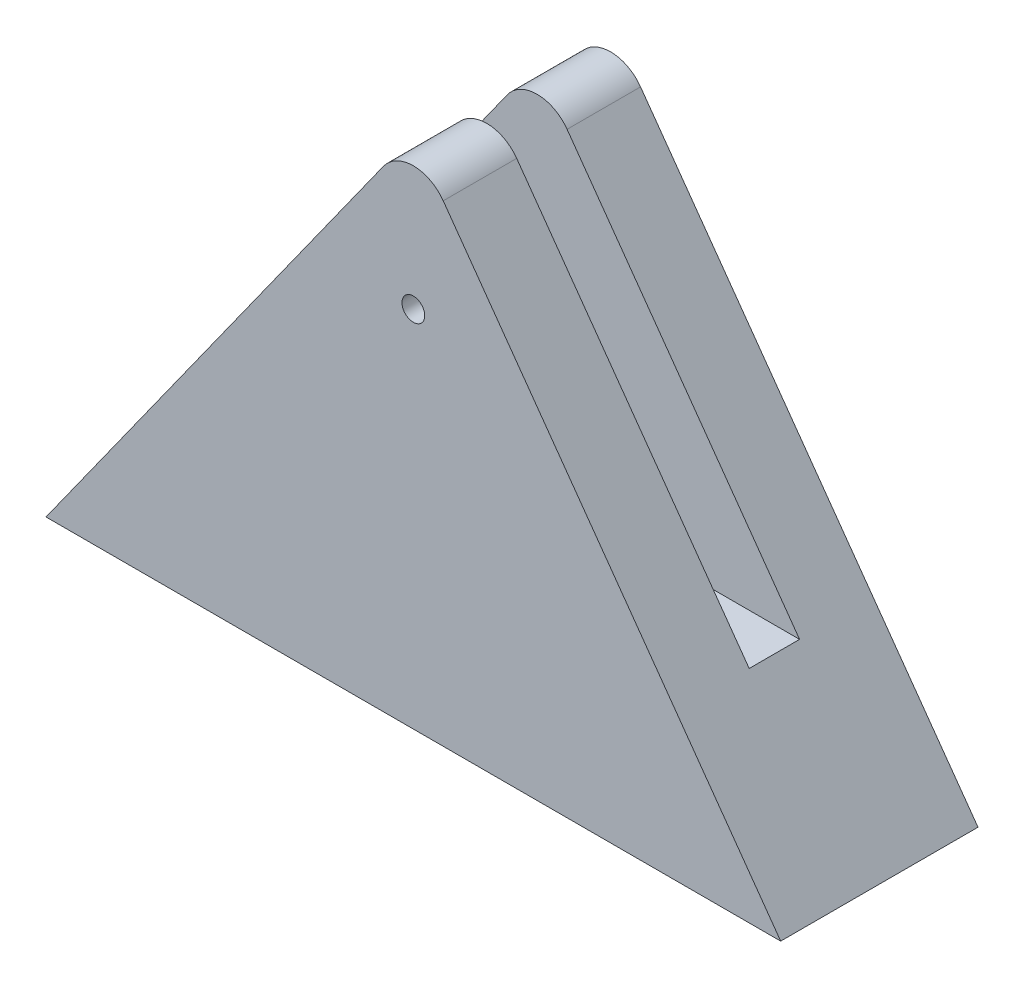
from build123d import *

# Parameters (mm, degrees)
BOSS_EXTRUDE1_DEPTH = 26.858
CUT_EXTRUDE1_REACH  = 113.995
SKETCH2_W           = 6.858
SKETCH2_H           = 50
CUT_EXTRUDE2_REACH  = 74.541
SKETCH3_R           = 1.55
FILLET1_R           = 5


with BuildPart() as part:
    # Sketch1 → Boss-Extrude1 (new body)
    with BuildSketch(Plane.XY):
        Polygon((-47.852923476, -42.680149177), (2.147076524, 27.319850823), (52.147076524, -42.680149177), align=None)
    extrude(amount=BOSS_EXTRUDE1_DEPTH)

    # Cut-Extrude1: up to this plane
    cut_extrude1_end = Plane(origin=(-47.852923476, -42.680149177, 26.858), z_dir=(0.8137334712067356, -0.5812381937190956, 0))
    # Sketch2 → Cut-Extrude1 (cut, up to the surface)
    with BuildSketch(Plane.ZY.offset(-52.147076524), mode=Mode.PRIVATE) as cut_extrude1_sk1:
        with Locations((13.429, 2.319850823)):
            Rectangle(SKETCH2_W, SKETCH2_H)
    cut_extrude1_tool1 = split(extrude(cut_extrude1_sk1.sketch, amount=CUT_EXTRUDE1_REACH, mode=Mode.PRIVATE), bisect_by=cut_extrude1_end, keep=Keep.BOTH, mode=Mode.PRIVATE)
    add(cut_extrude1_tool1.solids().sort_by_distance((52.147077, 2.319851, 13.429))[0], mode=Mode.SUBTRACT)

    # Cut-Extrude2: up to this face of the body (flat: up to its plane)
    cut_extrude2_end = Plane(part.part.faces().sort_by_distance((2.147076524, -19.346815843, 0))[0])
    # Sketch3 → Cut-Extrude2 (cut, up to the picked face)
    with BuildSketch(Plane.XY.offset(26.858), mode=Mode.PRIVATE) as cut_extrude2_sk1:
        with Locations((2.147076524, 6.819850823)):
            Circle(SKETCH3_R)
    cut_extrude2_tool1 = split(extrude(cut_extrude2_sk1.sketch, amount=-CUT_EXTRUDE2_REACH, mode=Mode.PRIVATE), bisect_by=cut_extrude2_end, keep=Keep.BOTH, mode=Mode.PRIVATE)
    add(cut_extrude2_tool1.solids().sort_by(Axis((2.147077, 6.819851, 26.858), (0, 0, -1)))[0], mode=Mode.SUBTRACT)

    # Fillet1
    fillet1_edges = [part.edges().sort_by_distance(p)[0] for p in [
        (2.147076524, 27.319850823, 5),
        (2.147076524, 27.319850823, 21.858),
    ]]
    fillet(fillet1_edges, radius=FILLET1_R)


solid = part.part
